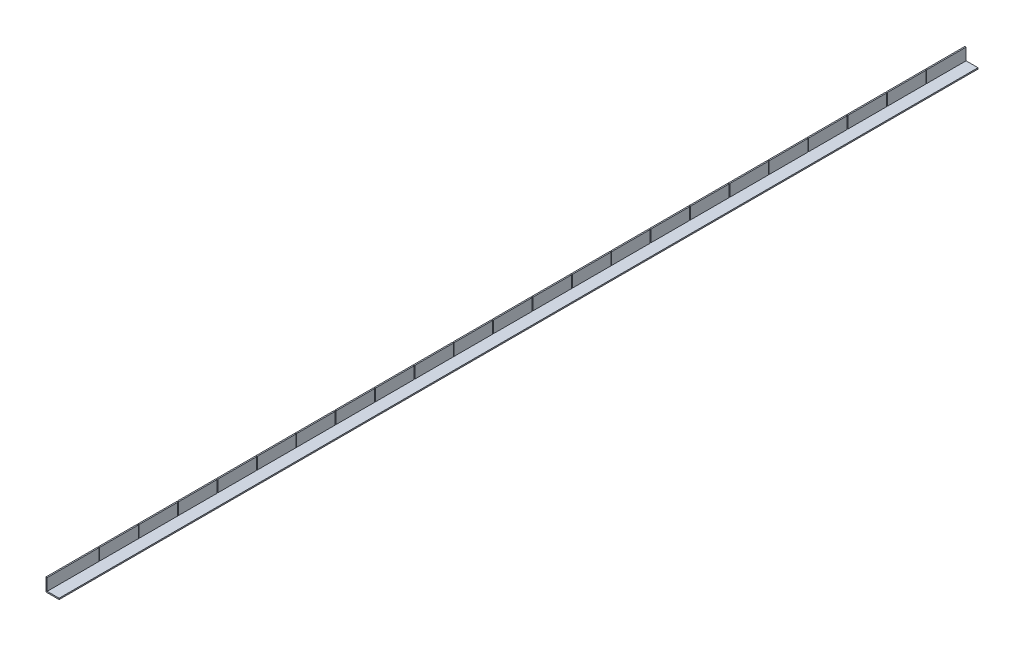
from build123d import *

# Parameters (mm, degrees)
BOSS_EXTRUDE1_DEPTH = 3556
CUT_EXTRUDE1_REACH  = 3558.661
SKETCH2_W           = 3.175
SKETCH2_H           = 46.0375
LPATTERN1_COUNT     = 22
LPATTERN1_PITCH     = 152.4


with BuildPart() as part:
    # Sketch1 → Boss-Extrude1 (new body)
    with BuildSketch(Plane.XY):
        Polygon((0, 0), (50.8, 0), (50.8, 4.7625), (4.7625, 4.7625), (4.7625, 50.8), (0, 50.8), align=None)
    extrude(amount=BOSS_EXTRUDE1_DEPTH)

    # Sketch2 → Cut-Extrude1 (cut, up to next)
    with BuildSketch(Plane(origin=(4.7625, 0, 0), x_dir=(0, 0, -1), z_dir=(1, 0, 0)), mode=Mode.PRIVATE) as cut_extrude1_sk1:
        with Locations((-153.9875, 27.78125)):
            Rectangle(SKETCH2_W, SKETCH2_H)
    cut_extrude1_tool1 = extrude(cut_extrude1_sk1.sketch, amount=-CUT_EXTRUDE1_REACH, mode=Mode.PRIVATE) & part.part
    cut_extrude1 = cut_extrude1_tool1.solids().sort_by_distance((4.7625, 27.78125, 153.9875))[0]
    add(cut_extrude1, mode=Mode.SUBTRACT)

    # LPattern1: Cut-Extrude1 ×22
    with Locations(*[(0, 0, i * LPATTERN1_PITCH) for i in range(1, LPATTERN1_COUNT)]):
        add(cut_extrude1, mode=Mode.SUBTRACT)


solid = part.part
